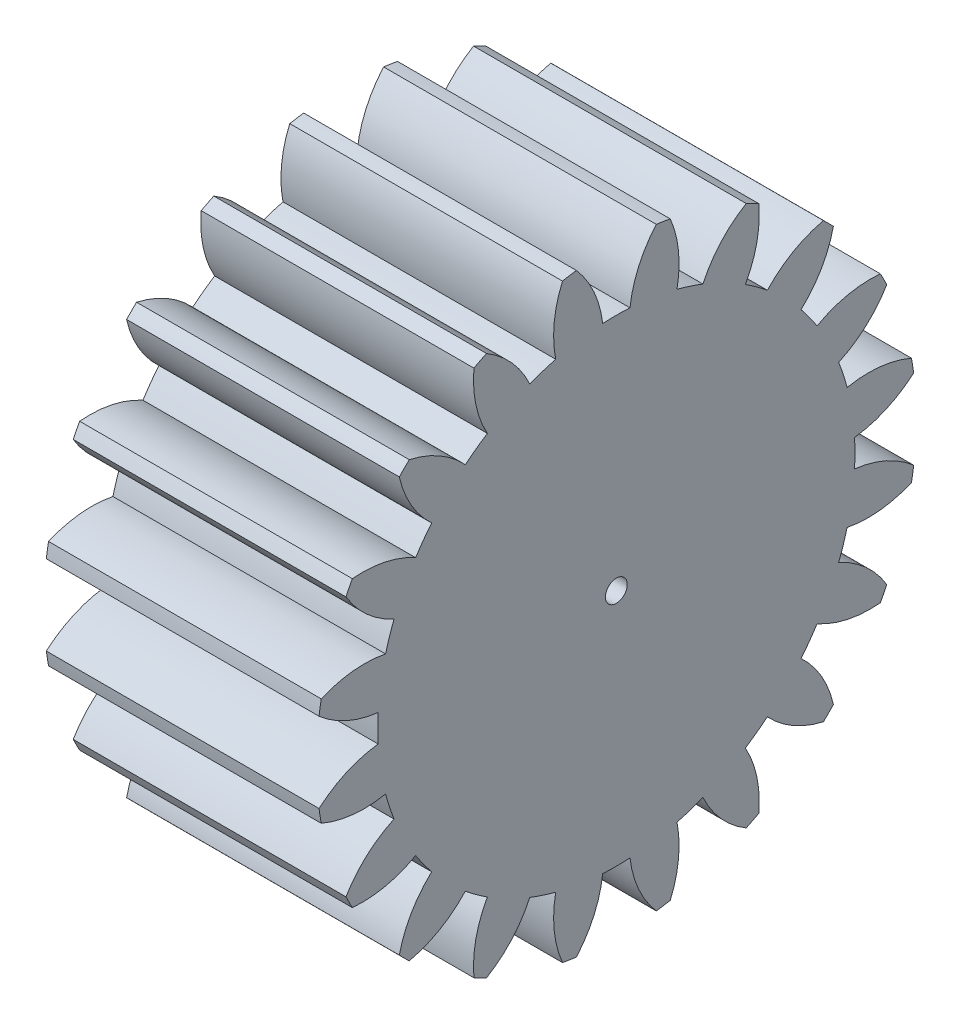
from build123d import *

# Parameters (mm, degrees)
BASPROSKE_W     = 10
BASPROSKE_H     = 11
TOOTHCUT_DEPTH  = 19.493242009
TEETHCUTS_COUNT = 20
BORSKE_R        = 0.4
BORE_DEPTH      = 50.0000508


with BuildPart() as part:
    # BasProSke → Base-Revolve (revolve)
    with BuildSketch(Plane(origin=(0, 0, 0), x_dir=(1, 0, 0), z_dir=(0, 1, 0)), mode=Mode.PRIVATE) as base_revolve_sk:
        with Locations((5, 5.5)):
            Rectangle(BASPROSKE_W, BASPROSKE_H)
    revolve(base_revolve_sk.sketch.rotate(Axis((-10, 0, 0), (1, 0, 0)), 180), axis=Axis((-10, 0, 0), (1, 0, 0)))

    # TooCutSke → ToothCut (cut, through all)
    with BuildSketch(Plane(origin=(0, 0, 0), x_dir=(0, 0, -1), z_dir=(1, 0, 0))):
        with BuildLine():
            ThreePointArc((0.499924007, 8.734705318), (0, 8.749), (-0.499924007, 8.734705318))
            ThreePointArc((-0.499924007, 8.734705318), (-0.824302243, 9.905497836), (-1.485192705, 10.924909509))
            ThreePointArc((-1.485192705, 10.924909509), (0, 11.0254), (1.485192705, 10.924909509))
            ThreePointArc((1.485192705, 10.924909509), (0.824302243, 9.905497836), (0.499924007, 8.734705318))
        make_face()
    toothcut = extrude(amount=TOOTHCUT_DEPTH, mode=Mode.SUBTRACT)

    # TeethCuts: ToothCut ×20 about axis
    teethcuts_axis = Axis((0, 0, 0), (1, 0, 0))
    for i in range(1, TEETHCUTS_COUNT):
        add(toothcut.rotate(teethcuts_axis, i * 360 / TEETHCUTS_COUNT), mode=Mode.SUBTRACT)

    # BorSke → Bore (cut, symmetric)
    with BuildSketch(Plane(origin=(0, 0, 0), x_dir=(0, 0, -1), z_dir=(1, 0, 0))):
        with Locations(Location((0, 0, 0), (0, 0, 180))):
            Circle(BORSKE_R)
    extrude(amount=BORE_DEPTH, both=True, mode=Mode.SUBTRACT)


solid = part.part
